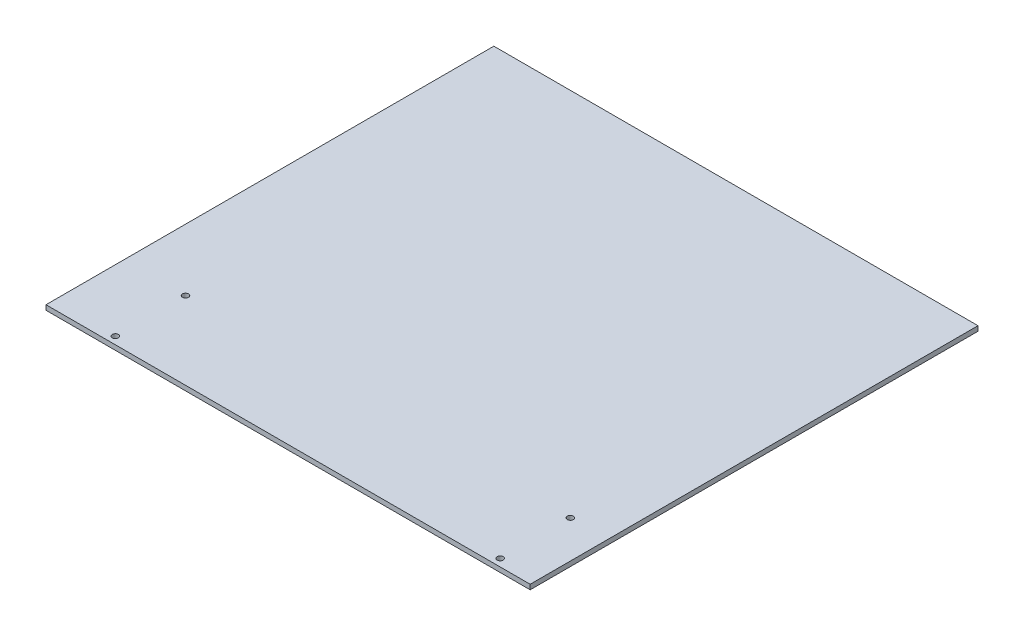
from build123d import *

# Parameters (mm, degrees)
SKETCH_1_W      = 200
SKETCH_1_H      = 185
EXTRUDE_1_DEPTH = 2
MM_D            = 2.5
MM_DEPTH        = 2
MM_TIP          = 0.751075774


with BuildPart() as part:
    # 草图1 → 凸台-拉伸1 (new body)
    with BuildSketch(Plane(origin=(0, 0, 0), x_dir=(1, 0, 0), z_dir=(0, 1, 0))):
        Rectangle(SKETCH_1_W, SKETCH_1_H)
    extrude(amount=EXTRUDE_1_DEPTH)

    # mm
    with Locations(Plane(origin=(-57.339436311, 0, -271.399294752), x_dir=(-1, 0, 0), z_dir=(0, -1, 0))):
        with Locations((-141.888564343, -331.831457961), (-141.888564343, -360.832120302), (17.106168369, -360.832120302), (17.106168369, -331.831457961)):
            Hole(MM_D / 2, depth=MM_DEPTH)
            with Locations((0, 0, -(MM_DEPTH + MM_TIP / 2))):  # 118° drill point
                Cone(0, MM_D / 2, MM_TIP, mode=Mode.SUBTRACT)


solid = part.part
